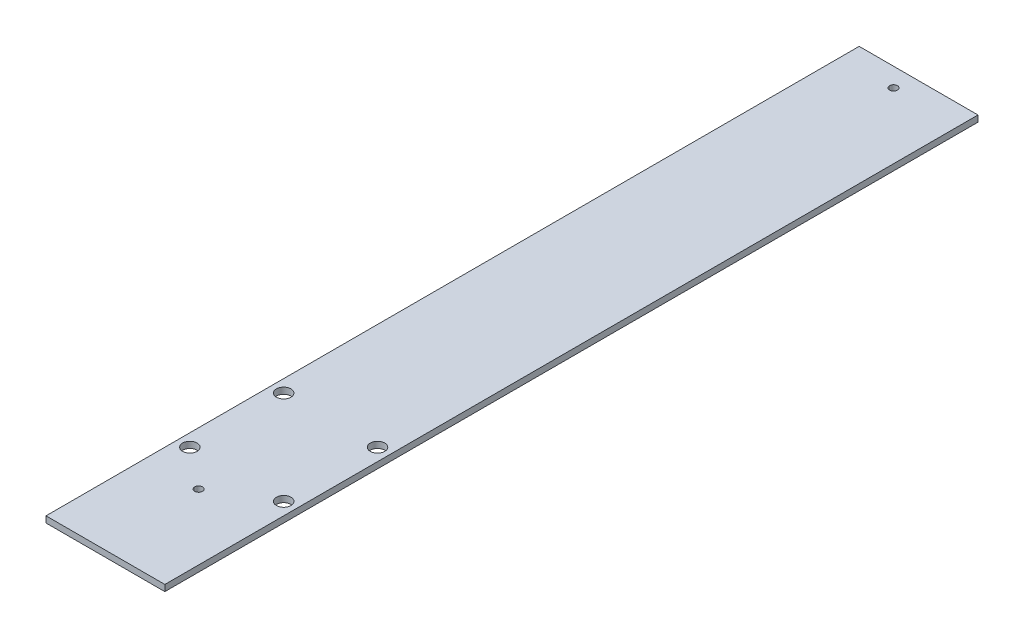
from build123d import *

# Parameters (mm, degrees)
SKETCH1_W               = 241.3
SKETCH1_H               = 1651
BOSS_EXTRUDE1_DEPTH     = 12.7
CUT_EXTRUDE1_DEPTH      = 1669.588619163
CUT_EXTRUDE1_DEPTH_BACK = 1669.588619163
SKETCH2_R               = 7.9375
SKETCH3_R               = 14.72946
CUT_EXTRUDE2_DEPTH      = 1669.588619163


with BuildPart() as part:
    # Sketch1 → Boss-Extrude1 (new body)
    with BuildSketch(Plane(origin=(0, 0, 0), x_dir=(1, 0, 0), z_dir=(0, 1, 0))):
        with Locations((120.65, -825.5)):
            Rectangle(SKETCH1_W, SKETCH1_H)
    extrude(amount=BOSS_EXTRUDE1_DEPTH)

    # Sketch2 → Cut-Extrude1 (cut, two sides: drawn at the far end of the back side and taken through both)
    with BuildSketch(Plane(origin=(0, 12.7, 0), x_dir=(1, 0, 0), z_dir=(0, 1, 0)).offset(-CUT_EXTRUDE1_DEPTH_BACK)):
        with Locations(Location((107.95, -38.1, 0), (0, 0, 270))):
            Circle(SKETCH2_R)
        with Locations(Location((107.95, -1449.0573, 0), (0, 0, 270))):
            Circle(SKETCH2_R)
    extrude(amount=CUT_EXTRUDE1_DEPTH + CUT_EXTRUDE1_DEPTH_BACK, mode=Mode.SUBTRACT)

    # Sketch3 → Cut-Extrude2 (cut, through all)
    with BuildSketch(Plane.XZ):
        with Locations(Location((215.9, 1193.8, 0), (0, 0, 270))):
            Circle(SKETCH3_R)
        with Locations(Location((25.4, 1193.8, 0), (0, 0, 270))):
            Circle(SKETCH3_R)
        with Locations(Location((25.4, 1384.3, 0), (0, 0, 270))):
            Circle(SKETCH3_R)
        with Locations(Location((215.9, 1384.3, 0), (0, 0, 270))):
            Circle(SKETCH3_R)
    extrude(amount=-CUT_EXTRUDE2_DEPTH, mode=Mode.SUBTRACT)


solid = part.part
